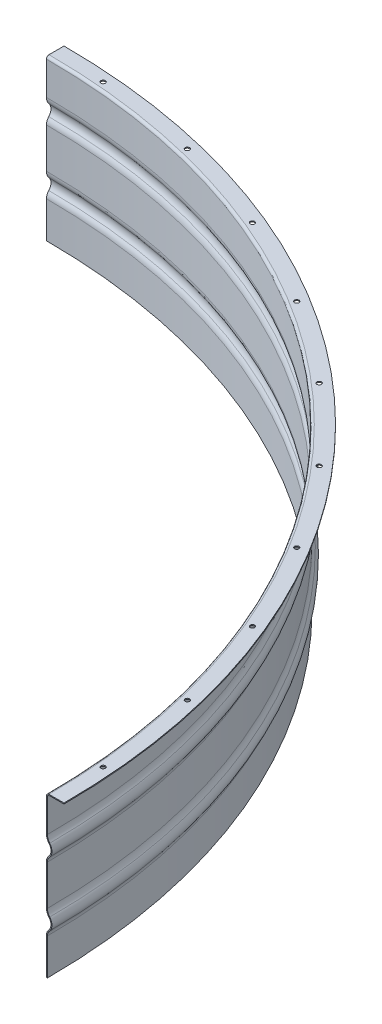
from build123d import *

# Parameters (mm, degrees)
REVOLVE1_ANGLE     = 90
SKETCH2_R          = 7
CUT_EXTRUDE1_DEPTH = 2719.294935026
CIRPATTERN1_COUNT  = 10
CIRPATTERN1_ANGLE  = 81


with BuildPart() as part:
    # Sketch1 → Revolve1 (revolve)
    with BuildSketch(Plane(origin=(0, 0, 0), x_dir=(0, 0, -1), z_dir=(1, 0, 0))):
        with BuildLine():
            ThreePointArc((1668.18678357, 678.502698393), (1663.349291107, 670.794245847), (1661.659054885, 661.851948853))
            Line((1661.659054885, 661.851948853), (1661.659054885, 548.005358054))
            Line((1661.659054885, 548.005358054), (1658.659054885, 548.005358054))
            Line((1658.659054885, 548.005358054), (1658.659054885, 661.851948852))
            ThreePointArc((1658.659054885, 661.851948852), (1660.556258803, 671.889220983), (1665.986097271, 680.541565679))
            ThreePointArc((1665.986097271, 680.541565679), (1672.827265195, 697.483265753), (1666.680039152, 714.688915753))
            ThreePointArc((1666.680039152, 714.688915753), (1660.728201813, 724.848073855), (1658.659054648, 736.439082916))
            Line((1658.659054648, 736.439082916), (1658.659054648, 861.851948852))
            ThreePointArc((1658.659054648, 861.851948852), (1660.556258566, 871.889220983), (1665.986097033, 880.541565679))
            ThreePointArc((1665.986097033, 880.541565679), (1672.827264958, 897.483265753), (1666.680038915, 914.688915753))
            ThreePointArc((1666.680038915, 914.688915753), (1660.728201582, 924.848073824), (1658.659054411, 936.439082853))
            Line((1658.659054411, 936.439082853), (1658.659054411, 1040.005358054))
            ThreePointArc((1658.659054411, 1040.005358054), (1661.002200161, 1045.662212304), (1666.659054411, 1048.005358054))
            Line((1666.659054411, 1048.005358054), (1713.659054411, 1048.005358054))
            Line((1713.659054411, 1048.005358054), (1713.659054411, 1045.005358054))
            Line((1713.659054411, 1045.005358054), (1666.659054411, 1045.005358054))
            ThreePointArc((1666.659054411, 1045.005358054), (1663.123520505, 1043.54089196), (1661.659054411, 1040.005358054))
            Line((1661.659054411, 1040.005358054), (1661.659054411, 936.439082853))
            ThreePointArc((1661.659054411, 936.439082853), (1663.54290482, 925.886074633), (1668.961741794, 916.636691913))
            ThreePointArc((1668.961741794, 916.636691913), (1675.826645674, 897.422312329), (1668.186783333, 878.502698393))
            ThreePointArc((1668.186783333, 878.502698393), (1663.349290869, 870.794245847), (1661.659054648, 861.851948853))
            Line((1661.659054648, 861.851948853), (1661.659054648, 736.43908291))
            ThreePointArc((1661.659054648, 736.43908291), (1663.542905053, 725.88607466), (1668.961742034, 716.636691911))
            ThreePointArc((1668.961742034, 716.636691911), (1675.826645911, 697.422312328), (1668.18678357, 678.502698393))
        make_face()
    revolve(axis=Axis((0, 1001.495453618, 336.340945352), (0, -1, 0)), revolution_arc=REVOLVE1_ANGLE)

    # Sketch2 → Cut-Extrude1 (cut, symmetric)
    with BuildSketch(Plane(origin=(0, 1048.005358054, 0), x_dir=(1, 0, 0), z_dir=(0, 1, 0))):
        with Locations(Location((158.48737337, 1677.432068789, 0), (0, 0, 90))):
            Circle(SKETCH2_R)
    cut_extrude1 = extrude(amount=CUT_EXTRUDE1_DEPTH, both=True, mode=Mode.SUBTRACT)

    # CirPattern1: Cut-Extrude1 ×10 about axis
    cirpattern1_axis = Axis((0, 0, 336.340945352), (0, -1, 0))
    for i in range(1, CIRPATTERN1_COUNT):
        add(cut_extrude1.rotate(cirpattern1_axis, i * CIRPATTERN1_ANGLE / (CIRPATTERN1_COUNT - 1)), mode=Mode.SUBTRACT)


solid = part.part
